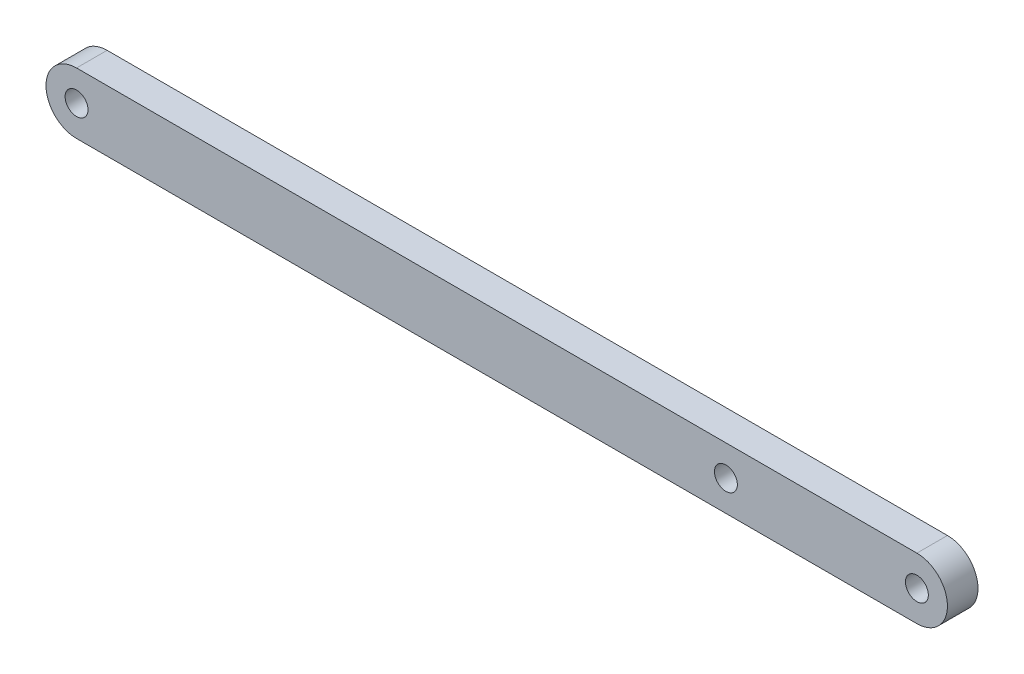
from build123d import *

# Parameters (mm, degrees)
SKETCH1_R           = 1.5
BOSS_EXTRUDE1_DEPTH = 4
SKETCH2_R           = 1.5
CUT_EXTRUDE1_DEPTH  = 10


with BuildPart() as part:
    # Sketch1 → Boss-Extrude1 (new body)
    with BuildSketch(Plane.XY):
        with BuildLine():
            Line((55, -4), (-55, -4))
            ThreePointArc((-55, -4), (-59, 0), (-55, 4))
            Line((-55, 4), (55, 4))
            ThreePointArc((55, 4), (59, 0), (55, -4))
        make_face()
        with Locations((-55, 0)):
            Circle(SKETCH1_R, mode=Mode.SUBTRACT)
        with Locations((55, 0)):
            Circle(SKETCH1_R, mode=Mode.SUBTRACT)
    extrude(amount=BOSS_EXTRUDE1_DEPTH)

    # Sketch2 → Cut-Extrude1 (cut)
    with BuildSketch(Plane.XY.offset(4)):
        with Locations((30, 0)):
            Circle(SKETCH2_R)
    extrude(amount=-CUT_EXTRUDE1_DEPTH, mode=Mode.SUBTRACT)


solid = part.part
